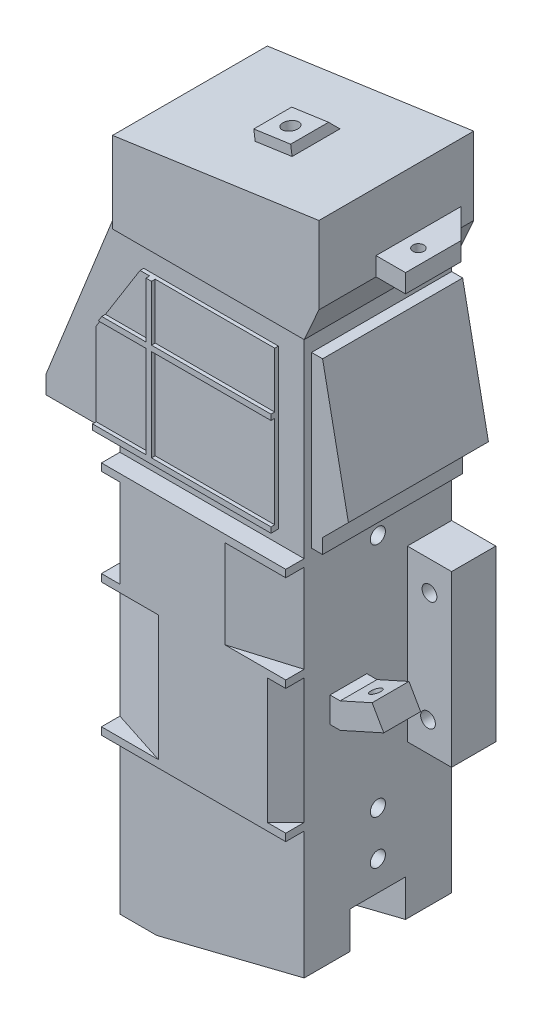
from build123d import *

# Parameters (mm, degrees)
CROQUIS1_W               = 50
CROQUIS1_H               = 184
SALIENTE_EXTRUIR1_DEPTH  = 40
CORTAR_EXTRUIR1_DEPTH    = 40
CROQUIS3_R               = 2
SALIENTE_EXTRUIR2_DEPTH  = 40
SALIENTE_EXTRUIR3_DEPTH  = 38
SALIENTE_EXTRUIR4_DEPTH  = 40
CROQUIS9_W               = 28
CROQUIS9_H               = 46
CORTAR_EXTRUIR6_DEPTH    = 12
CORTAR_EXTRUIR8_DEPTH    = 12
CROQUIS13_W              = 3.499793878
CROQUIS13_H              = 12
SALIENTE_EXTRUIR5_DEPTH  = 12
CROQUIS14_R              = 1.5
CORTAR_EXTRUIR9_DEPTH    = 12
CROQUIS16_W              = 10
CROQUIS16_H              = 6.928
SALIENTE_EXTRUIR6_DEPTH  = 2.773
SALIENTE_EXTRUIR7_DEPTH  = 5
CROQUIS19_R              = 1.5
CORTAR_EXTRUIR10_DEPTH   = 10
CROQUIS20_W              = 40
CROQUIS20_H              = 15
CORTAR_EXTRUIR11_DEPTH   = 20
SALIENTE_EXTRUIR8_DEPTH  = 40
SALIENTE_EXTRUIR9_DEPTH  = 40
SALIENTE_EXTRUIR10_DEPTH = 2
CROQUIS25_W              = 18
CROQUIS25_H              = 15
CORTAR_EXTRUIR12_DEPTH   = 45
CROQUIS26_R              = 1.6
CORTAR_EXTRUIR13_DEPTH   = 45
SALIENTE_EXTRUIR11_DEPTH = 1
CROQUIS29_W              = 48.431
CROQUIS29_H              = 1.5
CROQUIS29_W_2            = 1.5
CROQUIS29_H_2            = 41.5
SALIENTE_EXTRUIR12_DEPTH = 1
CROQUIS30_W              = 50
CROQUIS30_H              = 2
SALIENTE_EXTRUIR13_DEPTH = 5
SALIENTE_EXTRUIR14_DEPTH = 24
CORTAR_EXTRUIR14_DEPTH   = 5
CROQUIS33_W              = 50
CROQUIS33_H              = 5
SALIENTE_EXTRUIR15_DEPTH = 2
SALIENTE_EXTRUIR16_DEPTH = 34
CROQUIS35_W              = 50
CROQUIS35_H              = 5
SALIENTE_EXTRUIR17_DEPTH = 2
CROQUIS36_R              = 1.6
CORTAR_EXTRUIR15_DEPTH   = 123.497795141
CROQUIS37_R              = 2.05
CORTAR_EXTRUIR16_DEPTH   = 6
CROQUIS38_R              = 2.05
CORTAR_EXTRUIR17_DEPTH   = 6
CROQUIS39_W              = 10.109
CROQUIS39_H              = 13
SALIENTE_EXTRUIR18_DEPTH = 2.741
CORTAR_EXTRUIR18_DEPTH   = 123.414338069
CROQUIS42_R              = 2.05
CORTAR_EXTRUIR19_DEPTH   = 6


with BuildPart() as part:
    # Croquis1 → Saliente-Extruir1 (new body)
    with BuildSketch(Plane.XY):
        Rectangle(CROQUIS1_W, CROQUIS1_H)
    extrude(amount=SALIENTE_EXTRUIR1_DEPTH)

    # Croquis2 → Cortar-Extruir1 (cut)
    with BuildSketch(Plane.XY.offset(40)):
        Polygon((-15, -92), (25, -82.000231953), (25, -92), align=None)
    extrude(amount=-CORTAR_EXTRUIR1_DEPTH, mode=Mode.SUBTRACT)

    # Croquis3 → Saliente-Extruir2 (add, through all)
    with BuildSketch(Plane.XY.offset(40)):
        Polygon((25, -40.500231953), (17.257871302, -40.500231953), (17.257871302, 5.499768047), (23, 5.499768047), (37, 5.499768047), (37, -40.500231953), align=None)
        with Locations((30.600037882, -32.500231953)):
            Circle(CROQUIS3_R, mode=Mode.SUBTRACT)
        with Locations((31, -2.500231953)):
            Circle(CROQUIS3_R, mode=Mode.SUBTRACT)
    extrude(amount=-SALIENTE_EXTRUIR2_DEPTH)

    # Croquis7 → Saliente-Extruir3 (add)
    with BuildSketch(Plane(origin=(0, 0, 0), x_dir=(-1, 0, 0), z_dir=(0, 0, -1))):
        Polygon((-25, 17.999768047), (-28, 17.999768047), (-28, 21.999768047), (-34.999650027, 28.999418074), (-27.999635566, 63.999275882), (-25, 63.999275882), align=None)
    extrude(amount=-SALIENTE_EXTRUIR3_DEPTH)

    # Croquis8 → Saliente-Extruir4 (add, through all)
    with BuildSketch(Plane(origin=(0, 0, 0), x_dir=(-1, 0, 0), z_dir=(0, 0, -1))):
        Polygon((-25, 69.999275882), (-27, 69.999275882), (-31.000138025, 78.999370147), (-42.314138025, 78.999370147), (-42.314138025, 83.999370147), (-31.000138025, 83.999370147), (-31.000138025, 92), (-25, 92), align=None)
    extrude(amount=-SALIENTE_EXTRUIR4_DEPTH)

    # Croquis9 → Cortar-Extruir6 (cut)
    with BuildSketch(Plane(origin=(37, 0, 0), x_dir=(0, 0, -1), z_dir=(1, 0, 0))):
        with Locations((-26, -17.500231953)):
            Rectangle(CROQUIS9_W, CROQUIS9_H)
    extrude(amount=-CORTAR_EXTRUIR6_DEPTH, mode=Mode.SUBTRACT)

    # Croquis10 → Cortar-Extruir8 (cut)
    with BuildSketch(Plane.XZ.offset(-78.999370147)):
        Polygon((31.000138025, 40), (31.000138025, 26.5), (39.000138025, 26.5), (39.000138025, 11.5), (30.999931903, 3.499793878), (31.000138025, 0), (42.314138025, 0), (42.314138025, 40), align=None)
    extrude(amount=-CORTAR_EXTRUIR8_DEPTH, mode=Mode.SUBTRACT)

    # Croquis13 → Saliente-Extruir5 (add)
    with BuildSketch(Plane(origin=(31.000138025, 0, 0), x_dir=(0, 0, -1), z_dir=(1, 0, 0))):
        with Locations((-1.749896939, 84.999370147)):
            Rectangle(CROQUIS13_W, CROQUIS13_H)
    extrude(amount=-SALIENTE_EXTRUIR5_DEPTH)

    # Croquis14 → Cortar-Extruir9 (cut)
    with BuildSketch(Plane.XZ.offset(-78.999370147)):
        with Locations(Location((35.000138025, 19, 0), (0, 0, 270))):
            Circle(CROQUIS14_R)
    extrude(amount=-CORTAR_EXTRUIR9_DEPTH, mode=Mode.SUBTRACT)

    # Croquis16 → Saliente-Extruir6 (add)
    with BuildSketch(Plane(origin=(25, 0, 0), x_dir=(0, 0, -1), z_dir=(1, 0, 0))):
        with Locations((-28, -22.455231953)):
            Rectangle(CROQUIS16_W, CROQUIS16_H)
    extrude(amount=SALIENTE_EXTRUIR6_DEPTH)

    # Croquis3D1 → Saliente-Extruir7 (add, symmetric)
    with BuildSketch(Plane(origin=(27.773, -25.919231953, 28), x_dir=(0.6249550138681161, 0.7806607654039639, 0), z_dir=(0, 0, -1))):
        Polygon((0, 0), (11.53931357, 5.90842943), (13.864409677, 0), (5.408417783, -4.329688336), align=None)
    extrude(amount=SALIENTE_EXTRUIR7_DEPTH, both=True)

    # Croquis19 → Cortar-Extruir10 (cut)
    with BuildSketch(Plane(origin=(14.363025456, -31.948019069, 0), x_dir=(0.9120665622973847, 0.41004217580516156, 0), z_dir=(0.4100421758051615, -0.9120665622973846, 0))):
        with Locations((22.66684637, 28)):
            Circle(CROQUIS19_R)
    extrude(amount=-CORTAR_EXTRUIR10_DEPTH, mode=Mode.SUBTRACT)

    # Croquis20 → Cortar-Extruir11 (cut)
    with BuildSketch(Plane.XZ.offset(92)):
        with Locations((5, 20)):
            Rectangle(CROQUIS20_W, CROQUIS20_H)
    extrude(amount=-CORTAR_EXTRUIR11_DEPTH, mode=Mode.SUBTRACT)

    # Croquis21 → Saliente-Extruir8 (add)
    with BuildSketch(Plane(origin=(0, 0, 0), x_dir=(-1, 0, 0), z_dir=(0, 0, -1))):
        Polygon((25, 70), (27, 70), (45, 25), (45, 20), (25, 20), align=None)
    extrude(amount=-SALIENTE_EXTRUIR8_DEPTH)

    # Croquis22 → Saliente-Extruir9 (add)
    with BuildSketch(Plane.XY.offset(40)):
        Polygon((-25, 92), (31.000138025, 99.999370147), (31.000138025, 92), align=None)
    extrude(amount=-SALIENTE_EXTRUIR9_DEPTH)

    # Croquis23 → Saliente-Extruir10 (add)
    with BuildSketch(Plane.XY.offset(40)):
        Polygon((-25, 70), (25, 69.999275882), (27, 69.999275882), (31.000138025, 78.999370147), (31.000138025, 99.999370147), (-25, 92), align=None)
    extrude(amount=SALIENTE_EXTRUIR10_DEPTH)

    # Croquis25 → Cortar-Extruir12 (cut)
    with BuildSketch(Plane(origin=(0, 70, 0), x_dir=(1, 0, 0), z_dir=(0, 1, 0))):
        with Locations((-36, -20)):
            Rectangle(CROQUIS25_W, CROQUIS25_H)
    extrude(amount=-CORTAR_EXTRUIR12_DEPTH, mode=Mode.SUBTRACT)

    # Croquis26 → Cortar-Extruir13 (cut)
    with BuildSketch(Plane(origin=(0, 25, 0), x_dir=(1, 0, 0), z_dir=(0, 1, 0))):
        with Locations(Location((-36, -20, 0), (0, 0, 270))):
            Circle(CROQUIS26_R)
    extrude(amount=-CORTAR_EXTRUIR13_DEPTH, mode=Mode.SUBTRACT)

    # Croquis28 → Saliente-Extruir11 (add)
    with BuildSketch(Plane.XY.offset(40)):
        Polygon((-30.431, 20), (18, 20), (18, 63), (-18.529, 63), (-30.431, 43.969), align=None)
    extrude(amount=SALIENTE_EXTRUIR11_DEPTH)

    # Croquis29 → Saliente-Extruir12 (add)
    with BuildSketch(Plane.XY.offset(41)):
        with Locations((-6.2155, 20.75)):
            Rectangle(CROQUIS29_W, CROQUIS29_H)
        with Locations((-15.169, 42.25)):
            Rectangle(CROQUIS29_W_2, CROQUIS29_H_2)
        Polygon((-15.919, 47.99), (18, 47.99), (18, 46.49), (-28.854364931, 46.49), (-27.916263938, 47.99), align=None)
    extrude(amount=SALIENTE_EXTRUIR12_DEPTH)

    # Croquis30 → Saliente-Extruir13 (add)
    with BuildSketch(Plane.XY.offset(40)):
        with Locations((0, 15.538)):
            Rectangle(CROQUIS30_W, CROQUIS30_H)
    extrude(amount=SALIENTE_EXTRUIR13_DEPTH)

    # Croquis31 → Saliente-Extruir14 (add)
    with BuildSketch(Plane.XZ.offset(-14.538)):
        Polygon((-25, 40), (-20.000095901, 45), (8.461904099, 45), (25, 40), align=None)
    extrude(amount=SALIENTE_EXTRUIR14_DEPTH)

    # Croquis32 → Cortar-Extruir14 (cut)
    with BuildSketch(Plane.XY.offset(45)):
        Polygon((-20.000095901, 14.538), (-25, 7.467175508), (-25, 14.538), align=None)
    extrude(amount=-CORTAR_EXTRUIR14_DEPTH, mode=Mode.SUBTRACT)

    # Croquis33 → Saliente-Extruir15 (add)
    with BuildSketch(Plane.XZ.offset(9.462)):
        with Locations((0, 42.5)):
            Rectangle(CROQUIS33_W, CROQUIS33_H)
    extrude(amount=SALIENTE_EXTRUIR15_DEPTH)

    # Croquis34 → Saliente-Extruir16 (add)
    with BuildSketch(Plane.XZ.offset(11.462)):
        Polygon((-25, 40), (-9.51943722, 45), (19.99956278, 45), (25, 40), align=None)
    extrude(amount=SALIENTE_EXTRUIR16_DEPTH)

    # Croquis35 → Saliente-Extruir17 (add)
    with BuildSketch(Plane.XZ.offset(45.462)):
        with Locations((0, 42.5)):
            Rectangle(CROQUIS35_W, CROQUIS35_H)
    extrude(amount=SALIENTE_EXTRUIR17_DEPTH)

    # Croquis36 → Cortar-Extruir15 (cut, through all)
    with BuildSketch(Plane(origin=(-15, 0, 0), x_dir=(0, 0, -1), z_dir=(1, 0, 0))):
        with Locations((-20, -82)):
            Circle(CROQUIS36_R)
    extrude(amount=-CORTAR_EXTRUIR15_DEPTH, mode=Mode.SUBTRACT)

    # Croquis37 → Cortar-Extruir16 (cut)
    with BuildSketch(Plane(origin=(25, 0, 0), x_dir=(0, 0, -1), z_dir=(1, 0, 0))):
        with Locations((-20, -64)):
            Circle(CROQUIS37_R)
        with Locations((-20, -52)):
            Circle(CROQUIS37_R)
        with Locations((-20, 12)):
            Circle(CROQUIS37_R)
    extrude(amount=-CORTAR_EXTRUIR16_DEPTH, mode=Mode.SUBTRACT)

    # Croquis38 → Cortar-Extruir17 (cut)
    with BuildSketch(Plane(origin=(0, 0, 0), x_dir=(-1, 0, 0), z_dir=(0, 0, -1))):
        with Locations((-6.684, 79.619334724)):
            Circle(CROQUIS38_R)
        with Locations((2.316, 79.619334724)):
            Circle(CROQUIS38_R)
    extrude(amount=-CORTAR_EXTRUIR17_DEPTH, mode=Mode.SUBTRACT)

    # Croquis39 → Saliente-Extruir18 (add)
    with BuildSketch(Plane(origin=(-13.378916452, 93.660019994, 0), x_dir=(0.9899511012015357, 0.14141010299786488, 0), z_dir=(-0.14141010299786488, 0.9899511012015357, 0))):
        with Locations((17.775042007, -21)):
            Rectangle(CROQUIS39_W, CROQUIS39_H)
    extrude(amount=SALIENTE_EXTRUIR18_DEPTH)

    # Croquis40 → Cortar-Extruir18 (cut, through all)
    with BuildSketch(Plane(origin=(12.592714568, 1.798813155, 0), x_dir=(0, 0, 1), z_dir=(-0.9899511012015357, -0.14141010299786488, 0))):
        Polygon((14.5, 94.610753885), (15.746, 95.869753885), (17.211, 97.351753885), (14.5, 97.351753885), align=None)
    extrude(amount=-CORTAR_EXTRUIR18_DEPTH, mode=Mode.SUBTRACT)

    # Croquis42 → Cortar-Extruir19 (cut)
    with BuildSketch(Plane(origin=(-13.766521544, 96.373475963, 0), x_dir=(0.9899511012015357, 0.14141010299786486, 0), z_dir=(-0.14141010299786486, 0.9899511012015357, 0))):
        with Locations(Location((17.720542007, -22.5, 0), (0, 0, 180))):
            Circle(CROQUIS42_R)
    extrude(amount=-CORTAR_EXTRUIR19_DEPTH, mode=Mode.SUBTRACT)


solid = part.part
